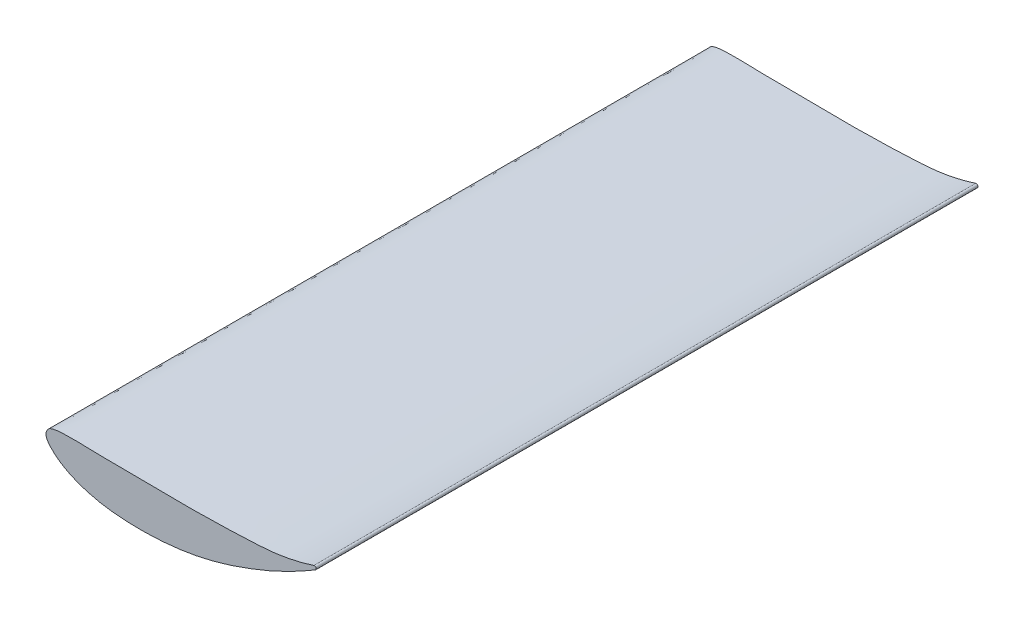
from build123d import *

# Parameters (mm, degrees)
BOSS_EXTRUDE1_DEPTH      = 450
BOSS_EXTRUDE1_DEPTH_BACK = 450


with BuildPart() as part:
    # Sketch1 → Boss-Extrude1 (new, two sides: drawn at the far end of the back side and taken through both)
    with BuildSketch(Plane.XY.offset(-BOSS_EXTRUDE1_DEPTH_BACK)):
        with BuildLine():
            ThreePointArc((442.688870749, 22.659370315), (444.187438989, 25.725606875), (441.121202429, 27.224175115))
            add(Edge.make_bspline(
                [(441.121202429, 27.224175115), (439.510228077, 26.670926166), (426.426084073, 22.545979065), (396.762494375, 15.334974116), (357.264669076, 12.831764415), (317.060904654, 11.317962918), (276.947389631, 10.50729673), (236.706569169, 10.672633019), (196.466834558, 11.719331143), (162.884284558, 11.023450348), (136.052882273, 12.241939125), (119.255808226, 12.325478326), (105.857064552, 12.386118084), (95.816112283, 12.022825119), (87.484198813, 10.885532536), (79.590265704, 8.204754583), (77.084711664, 3.063522952), (76.983702508, 0), (76.831004293, -4.631208741), (81.943396195, -11.14871336), (90.100351809, -19.21588606), (99.334705827, -25.73835917), (110.202976045, -31.540666456), (124.136845873, -37.362436938), (141.436679464, -42.468406605), (168.759453641, -47.308349676), (202.64815335, -49.21211695), (242.882591393, -47.413174996), (282.745502554, -41.780462892), (322.002478713, -31.695933514), (360.965045037, -17.820120305), (398.974347593, -1.642373625), (428.016959969, 13.996447342), (440.765728538, 21.488634074), (442.688870749, 22.659370315)],
                knots=[0.559158735, 0.559158735, 0.559158735, 0.559158735, 0.565818268, 0.613605216, 0.661046526, 0.708588115, 0.756202534, 0.803923893, 0.85170512, 0.8994162, 0.923358593, 0.947240764, 0.959163534, 0.97104367, 0.98292106, 0.98913236, 1, 1, 1, 1.016428899, 1.025764005, 1.041718401, 1.056085955, 1.069631519, 1.095356118, 1.120077524, 1.168217375, 1.215743697, 1.263211394, 1.311129181, 1.359856624, 1.409547024, 1.46067165, 1.46948594, 1.46948594, 1.46948594, 1.46948594], degree=3))
        make_face()
    extrude(amount=BOSS_EXTRUDE1_DEPTH + BOSS_EXTRUDE1_DEPTH_BACK)


solid = part.part
